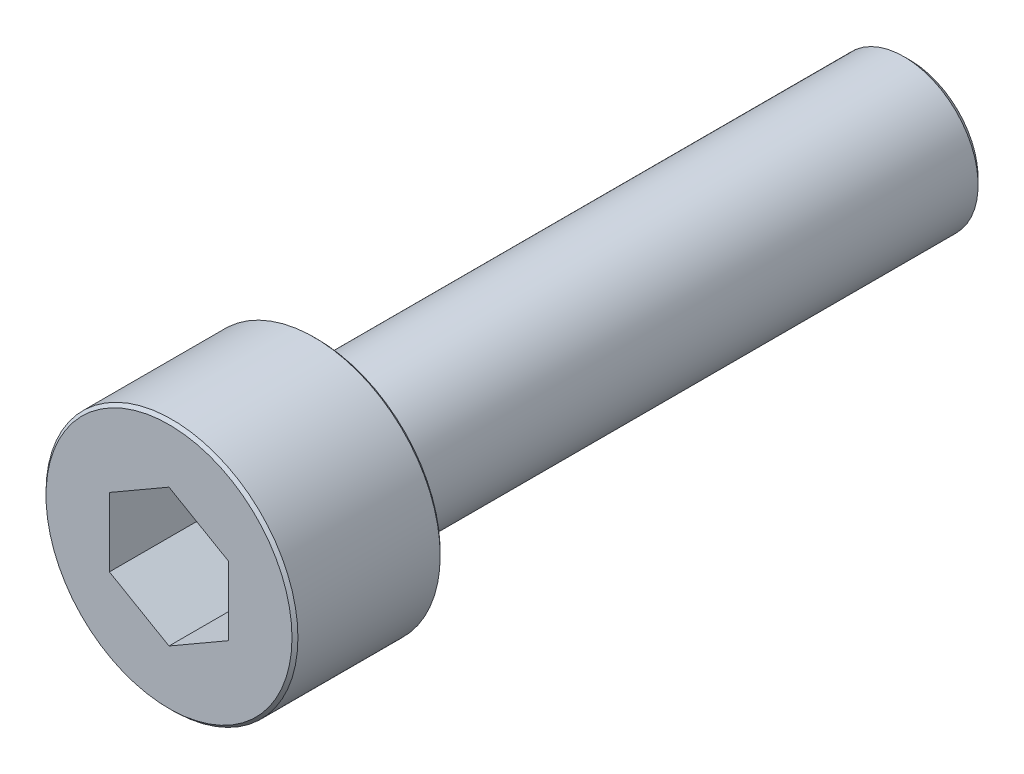
from build123d import *

# Parameters (mm, degrees)
SKETCH_1_W          = 4.25
SKETCH_1_H          = 5
SKETCH_2_R          = 2.5
EXTRUDE_1_DEPTH     = 20
CUT_EXTRUDE_1_DEPTH = 3.75
CHAMFER_1_SIZE2     = 0.100001795
CHAMFER_1_SIZE      = 0.100001726
CHAMFER_2_SIZE      = 0.200016825
CHAMFER_2_SIZE2     = 0.200018288


with BuildPart() as part:
    # 草图1 → 旋转1 (revolve)
    with BuildSketch(Plane(origin=(0, 0, 0), x_dir=(1, 0, 0), z_dir=(0, 1, 0))):
        with Locations((2.125, -22.5)):
            Rectangle(SKETCH_1_W, SKETCH_1_H)
    revolve(axis=Axis((0, 0, 20), (0, 0, 1)))

    # 草图2 → 凸台-拉伸1 (add)
    with BuildSketch(Plane(origin=(0, 0, 20), x_dir=(-1, 0, 0), z_dir=(0, 0, -1))):
        Circle(SKETCH_2_R)
    extrude(amount=EXTRUDE_1_DEPTH)

    # 草图3 → 切除-拉伸1 (cut)
    with BuildSketch(Plane.XY.offset(25)):
        Polygon((-2.01, -1.160474041), (0, -2.320948082), (2.01, -1.160474041), (2.01, 1.160474041), (0, 2.320948082), (-2.01, 1.160474041), align=None)
    extrude(amount=-CUT_EXTRUDE_1_DEPTH, mode=Mode.SUBTRACT)

    # 倒角1
    chamfer_1_edges = [part.edges().sort_by_distance(p)[0] for p in [
        (-4.25, 0, 25),
        (-4.25, 0, 20),
    ]]
    chamfer(chamfer_1_edges, length=CHAMFER_1_SIZE, length2=CHAMFER_1_SIZE2)

    # 倒角2
    chamfer_2_edges = [part.edges().sort_by_distance(p)[0] for p in [
        (2.5, 0, 0),
    ]]
    chamfer_2_side = [part.faces().sort_by_distance(p)[0] for p in [
        (2.5, 0, 10),
    ]]
    chamfer(chamfer_2_edges, length=CHAMFER_2_SIZE, length2=CHAMFER_2_SIZE2, reference=chamfer_2_side[0])


solid = part.part
